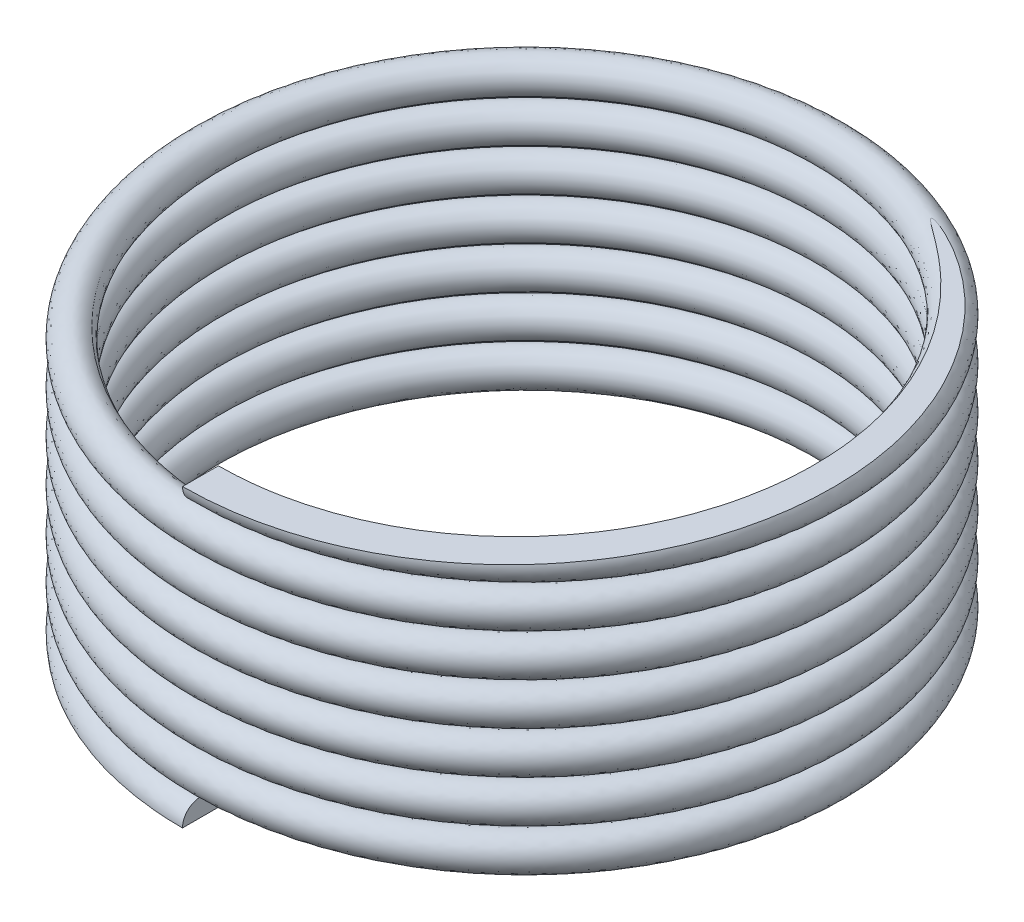
from build123d import *

# Parameters (mm, degrees)
SWEEP1_PITCH       = 0.508
SWEEP1_HEIGHT      = 3.556
SWEEP1_RADIUS      = 3.7465
SKETCH2_R          = 0.2159
SKETCH9_R          = 5.687680275
CUT_EXTRUDE1_DEPTH = 2.54
SKETCH10_R         = 5.083589078
CUT_EXTRUDE2_DEPTH = 2.54


with BuildPart() as part:
    # Sweep1: sweep along a helix
    with BuildLine() as sweep1_path:
        Helix(SWEEP1_PITCH, SWEEP1_HEIGHT, SWEEP1_RADIUS, center=(0, 0, 0), direction=(0, 1, 0), lefthand=True)
    # Sketch2 → Sweep1 (sweep)
    with BuildSketch(Plane(origin=(0, 0, 0), x_dir=(0, 0, -1), z_dir=(1, 0, 0))):
        with Locations((-3.7465, 0)):
            Circle(SKETCH2_R)
    sweep(path=sweep1_path.line, is_frenet=True)

    # Sketch9 → Cut-Extrude1 (cut)
    with BuildSketch(Plane(origin=(0, 0, 0), x_dir=(1, 0, 0), z_dir=(0, 1, 0))):
        with Locations((0, 0.087851476)):
            Circle(SKETCH9_R)
    extrude(amount=-CUT_EXTRUDE1_DEPTH, mode=Mode.SUBTRACT)

    # Sketch10 → Cut-Extrude2 (cut)
    with BuildSketch(Plane(origin=(0, 3.556, 0), x_dir=(1, 0, 0), z_dir=(0, 1, 0))):
        Circle(SKETCH10_R)
    extrude(amount=CUT_EXTRUDE2_DEPTH, mode=Mode.SUBTRACT)


solid = part.part
